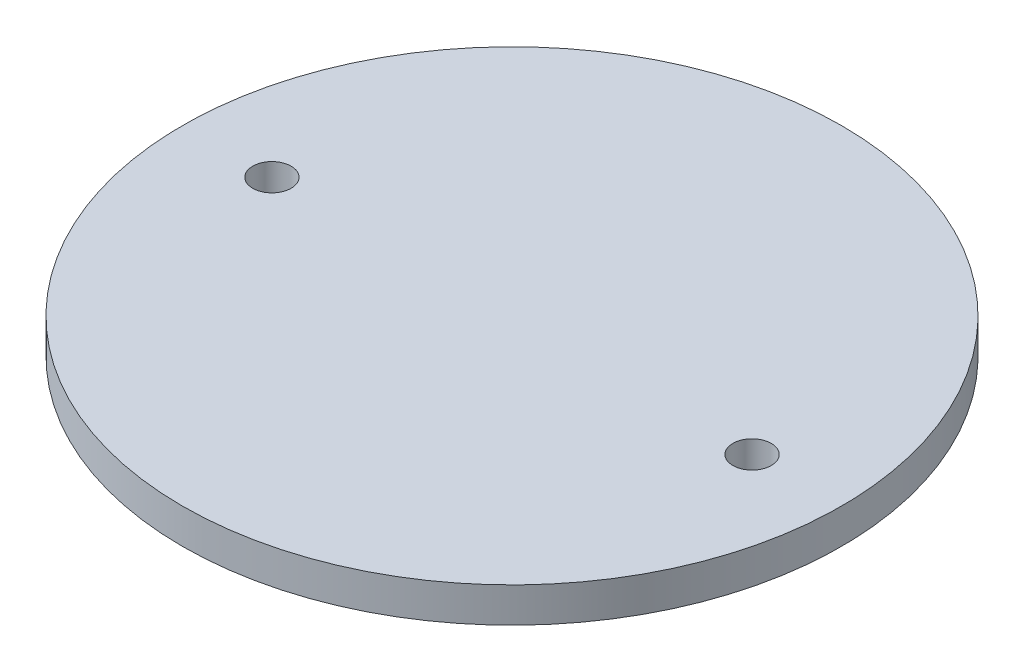
from build123d import *

# Parameters (mm, degrees)
SKETCH1_R           = 37.75
SKETCH1_R_2         = 2.2
BOSS_EXTRUDE1_DEPTH = 4


with BuildPart() as part:
    # Sketch1 → Boss-Extrude1 (new body)
    with BuildSketch(Plane(origin=(0, 0, 0), x_dir=(1, 0, 0), z_dir=(0, 1, 0))):
        with Locations(Location((0, 0, 0), (0, 0, 270))):
            Circle(SKETCH1_R)
        with Locations(Location((-27.5, 0, 0), (0, 0, 270))):
            Circle(SKETCH1_R_2, mode=Mode.SUBTRACT)
        with Locations(Location((27.5, 0, 0), (0, 0, 270))):
            Circle(SKETCH1_R_2, mode=Mode.SUBTRACT)
    extrude(amount=BOSS_EXTRUDE1_DEPTH)


solid = part.part
